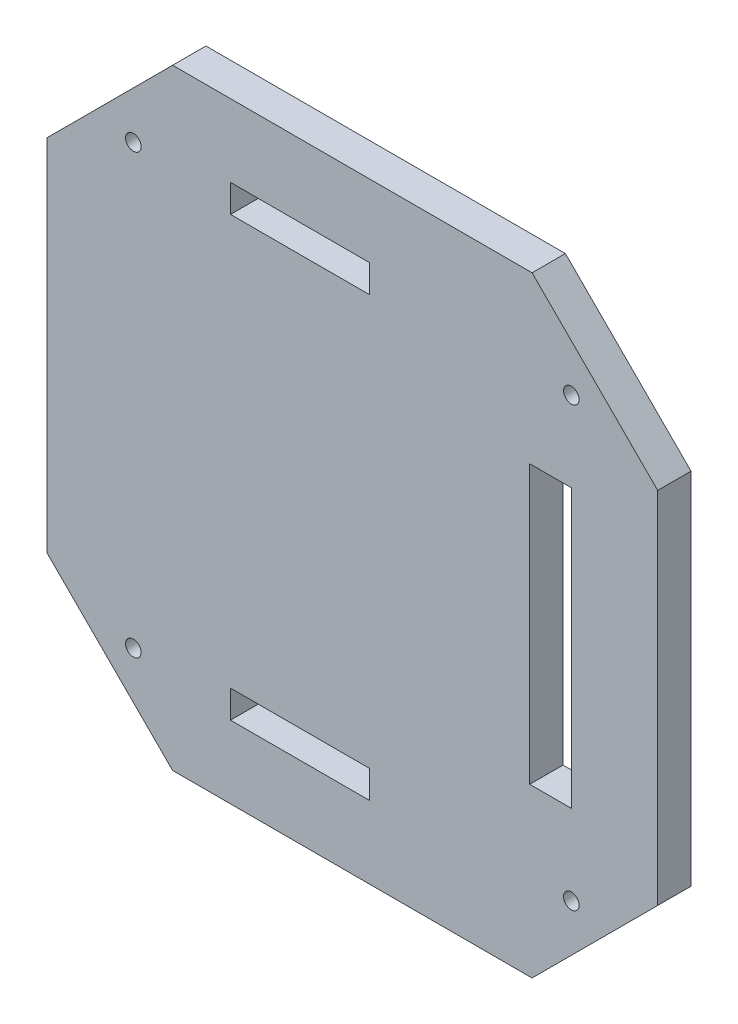
from build123d import *

# Parameters (mm, degrees)
ESQUISSE1_R                                = 1.4
BOSS_EXTRU_1_DEPTH                         = 6
ESQUISSE2_R                                = 3.25
ENL_V_MAT_EXTRU_1_DEPTH                    = 3
SYM_TRIE3_AT_THE_SECOND_PLANE_COPY_1_SKE_R = 3.25
SYM_TRIE3_AT_THE_SECOND_PLANE_COPY_1_DEPTH = 3
ESQUISSE4_W                                = 25
ESQUISSE4_H                                = 5
ESQUISSE4_W_2                              = 7.5
ESQUISSE4_H_2                              = 50
ENL_V_MAT_EXTRU_2_DEPTH                    = 102.655363655


with BuildPart() as part:
    # Esquisse1 → Boss.-Extru.1 (new body)
    with BuildSketch(Plane(origin=(0, 0, -27.5), x_dir=(-1, 0, 0), z_dir=(0, 0, -1))):
        Polygon((-2.565563678, -55.727752809), (62.179602326, -55.727752809), (84.807019324, -33.100335811), (84.807019324, 31.644830193), (62.179602326, 54.272247191), (-2.565563678, 54.272247191), (-25.192980676, 31.644830193), (-25.192980676, -33.100335811), align=None)
        with Locations((-9.63663149, 38.715898005)):
            Circle(ESQUISSE1_R, mode=Mode.SUBTRACT)
        with Locations((69.250670138, 38.715898005)):
            Circle(ESQUISSE1_R, mode=Mode.SUBTRACT)
        with Locations((69.250670138, -40.171403623)):
            Circle(ESQUISSE1_R, mode=Mode.SUBTRACT)
        with Locations((-9.63663149, -40.171403623)):
            Circle(ESQUISSE1_R, mode=Mode.SUBTRACT)
    extrude(amount=BOSS_EXTRU_1_DEPTH)

    # Esquisse2 → Enlèv. mat.-Extru.1 (cut)
    with BuildSketch(Plane(origin=(0, 0, -33.5), x_dir=(-1, 0, 0), z_dir=(0, 0, -1))):
        with Locations((69.250670138, 38.715898005)):
            Circle(ESQUISSE2_R)
    enl_v_mat_extru_1 = extrude(amount=-ENL_V_MAT_EXTRU_1_DEPTH, mode=Mode.SUBTRACT)

    # Symétrie3: Enlèv. mat.-Extru.1 across plane
    add(enl_v_mat_extru_1.mirror(Plane(origin=(-29.807019324, 0, 0), x_dir=(0, 0, 1), z_dir=(1, 0, 0))), mode=Mode.SUBTRACT)

    # Symétrie3 at the second plane: Enlèv. mat.-Extru.1 across plane
    add(enl_v_mat_extru_1.mirror(Plane(origin=(0, -0.727752809, 0), x_dir=(0, 0, 1), z_dir=(0, -1, 0))), mode=Mode.SUBTRACT)

    # Symétrie3 at the second plane copy 1 ske → Symétrie3 at the second plane copy 1 (cut)
    with BuildSketch(Plane(origin=(-59.614038648, -1.455505618, -33.5), x_dir=(1, 0, 0), z_dir=(0, 0, -1))):
        with Locations((69.250670138, 38.715898005)):
            Circle(SYM_TRIE3_AT_THE_SECOND_PLANE_COPY_1_SKE_R)
    extrude(amount=-SYM_TRIE3_AT_THE_SECOND_PLANE_COPY_1_DEPTH, mode=Mode.SUBTRACT)

    # Esquisse4 → Enlèv. mat.-Extru.2 (cut, through all)
    with BuildSketch(Plane(origin=(0, 0, -33.5), x_dir=(-1, 0, 0), z_dir=(0, 0, -1))):
        with Locations((39.250670138, -40.171403623)):
            Rectangle(ESQUISSE4_W, ESQUISSE4_H)
        with Locations((39.250670138, 38.715898005)):
            Rectangle(ESQUISSE4_W, ESQUISSE4_H)
        with Locations((-5.88663149, -0.727752809)):
            Rectangle(ESQUISSE4_W_2, ESQUISSE4_H_2)
    extrude(amount=-ENL_V_MAT_EXTRU_2_DEPTH, mode=Mode.SUBTRACT)


solid = part.part
